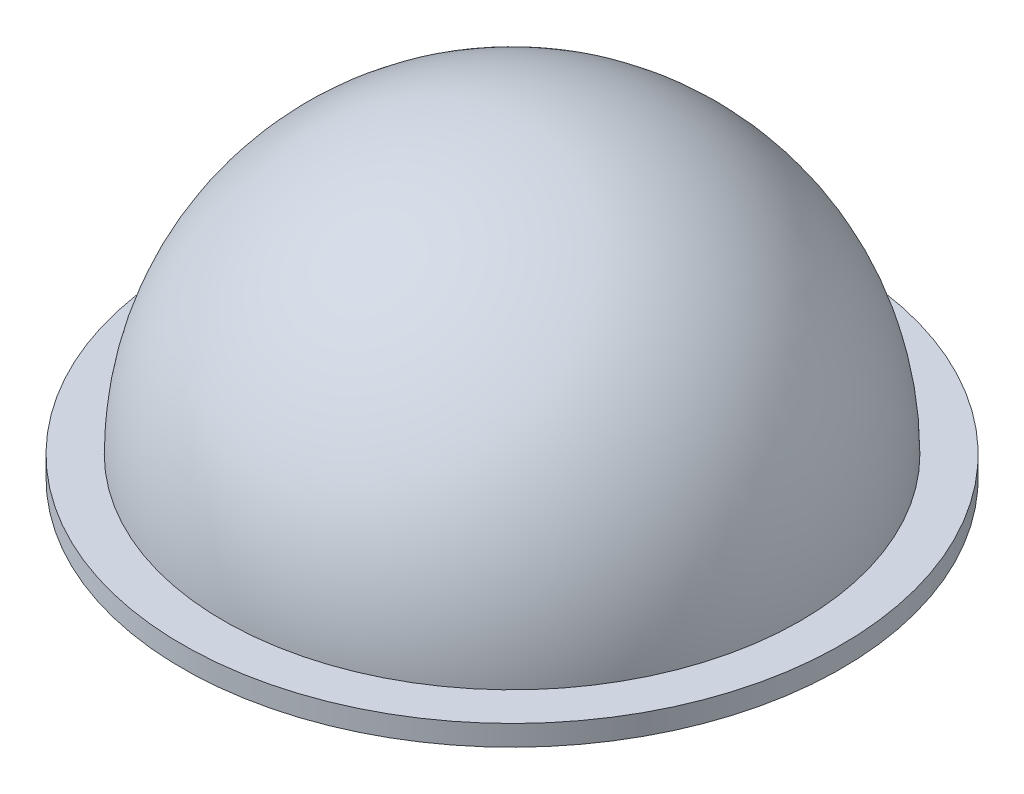
from build123d import *


with BuildPart() as part:
    # Sketch1 → Revolve1 (revolve)
    with BuildSketch(Plane.XY, mode=Mode.PRIVATE) as revolve1_sk:
        with BuildLine():
            Line((85.55, 0), (101.6, 0))
            Line((101.6, 0), (101.6, 6.35))
            Line((101.6, 6.35), (88.9, 6.35))
            ThreePointArc((88.9, 6.35), (62.861792847, 69.211792847), (0, 95.25))
            Line((0, 95.25), (0, 88.9))
            ThreePointArc((0, 88.9), (58.371664787, 64.721664787), (82.55, 6.35))
            Line((82.55, 6.35), (82.55, 3))
            Line((82.55, 3), (85.55, 0))
        make_face()
    revolve(revolve1_sk.sketch.rotate(Axis((0, 0, 0), (0, 1, 0)), 90), axis=Axis((0, 0, 0), (0, 1, 0)))


solid = part.part
